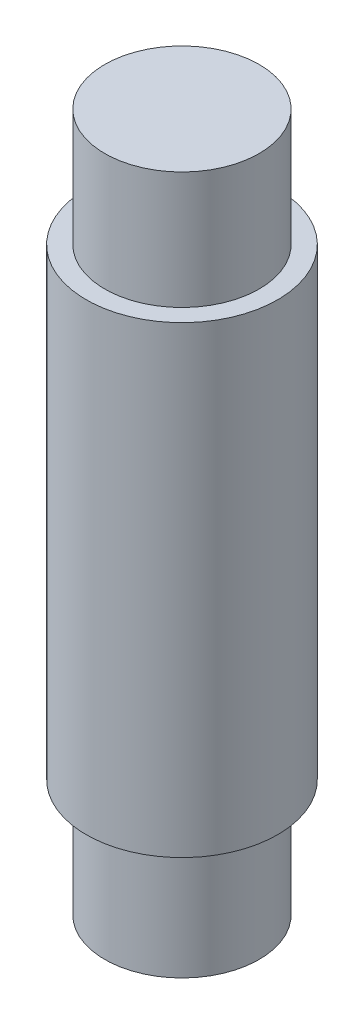
from build123d import *


with BuildPart() as part:
    # Sketch1 → Revolve1 (revolve)
    with BuildSketch(Plane.XY, mode=Mode.PRIVATE) as revolve1_sk:
        Polygon((0, 0), (0, -4.826), (0.762, -4.826), (0.762, -23.876), (0, -23.876), (0, -28.702), (-3.175, -28.702), (-3.175, 0), align=None)
    revolve(revolve1_sk.sketch.rotate(Axis((-3.175, -28.702, 0), (0, 1, 0)), 90), axis=Axis((-3.175, -28.702, 0), (0, 1, 0)))


solid = part.part
